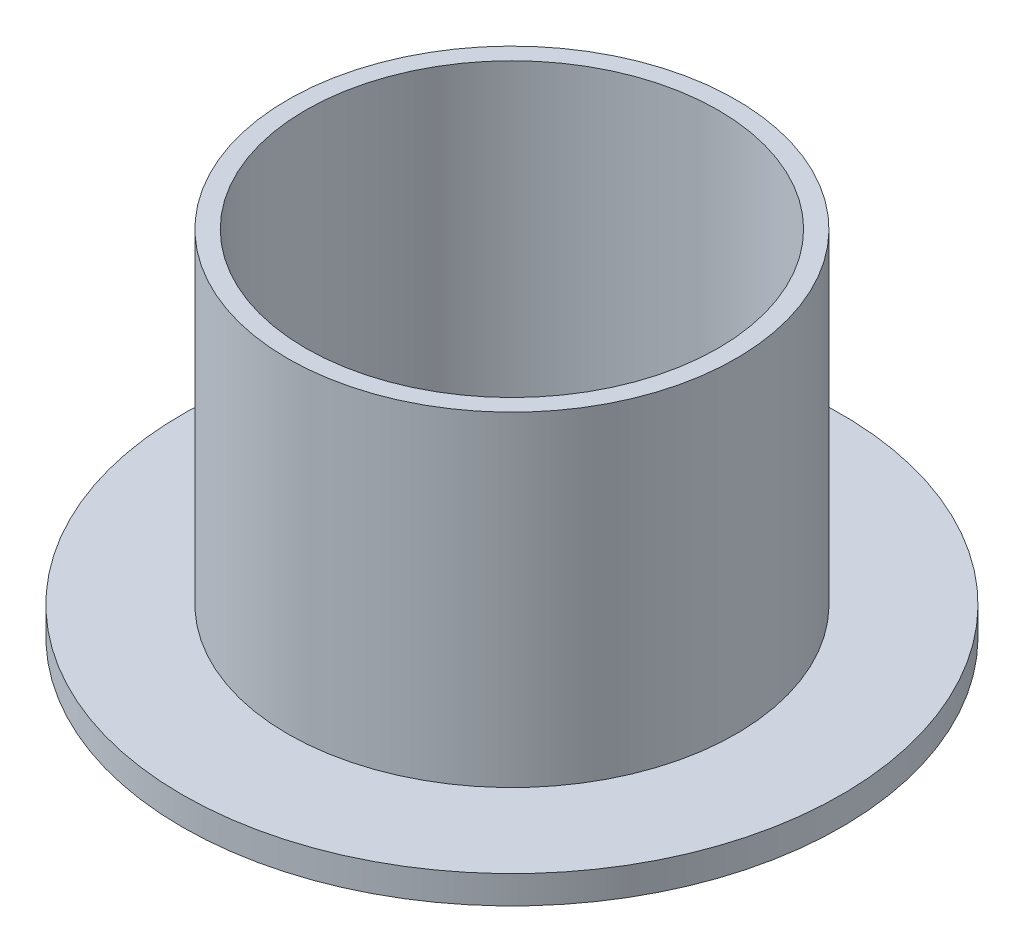
from build123d import *

# Parameters (mm, degrees)
SKETCH1_R           = 25.4
SKETCH1_R_2         = 23.368
BOSS_EXTRUDE1_DEPTH = 40.005
SKETCH1_3_R         = 37.338
SKETCH1_3_R_2       = 25.4
BOSS_EXTRUDE2_DEPTH = 3.175


with BuildPart() as part:
    # Sketch1 → Boss-Extrude1 (new body)
    with BuildSketch(Plane(origin=(0, 0, 0), x_dir=(1, 0, 0), z_dir=(0, 1, 0))):
        Circle(SKETCH1_R)
        Circle(SKETCH1_R_2, mode=Mode.SUBTRACT)
    extrude(amount=BOSS_EXTRUDE1_DEPTH)

    # Sketch1<3> → Boss-Extrude2 (add)
    with BuildSketch(Plane(origin=(0, 0, 0), x_dir=(1, 0, 0), z_dir=(0, 1, 0))):
        Circle(SKETCH1_3_R)
        Circle(SKETCH1_3_R_2, mode=Mode.SUBTRACT)
    extrude(amount=BOSS_EXTRUDE2_DEPTH)


solid = part.part
